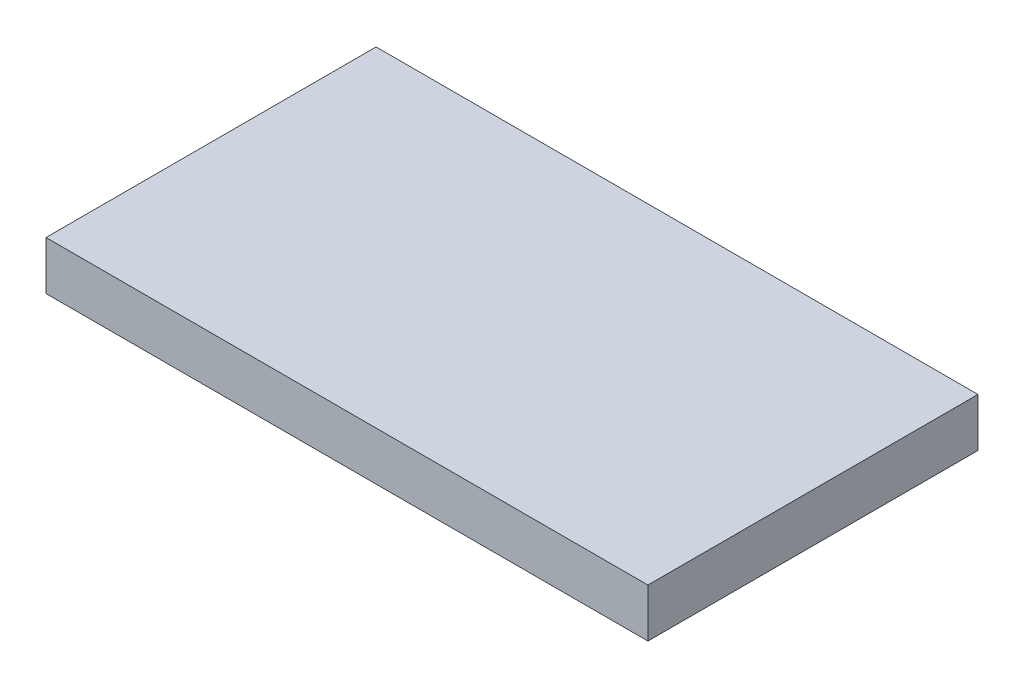
from build123d import *

# Parameters (mm, degrees)
SKETCH1_W           = 62
SKETCH1_H           = 34
BOSS_EXTRUDE1_DEPTH = 5


with BuildPart() as part:
    # Sketch1 → Boss-Extrude1 (new body)
    with BuildSketch(Plane(origin=(0, 0, 0), x_dir=(1, 0, 0), z_dir=(0, 1, 0))):
        with Locations((31, 17)):
            Rectangle(SKETCH1_W, SKETCH1_H)
    extrude(amount=BOSS_EXTRUDE1_DEPTH)


solid = part.part
